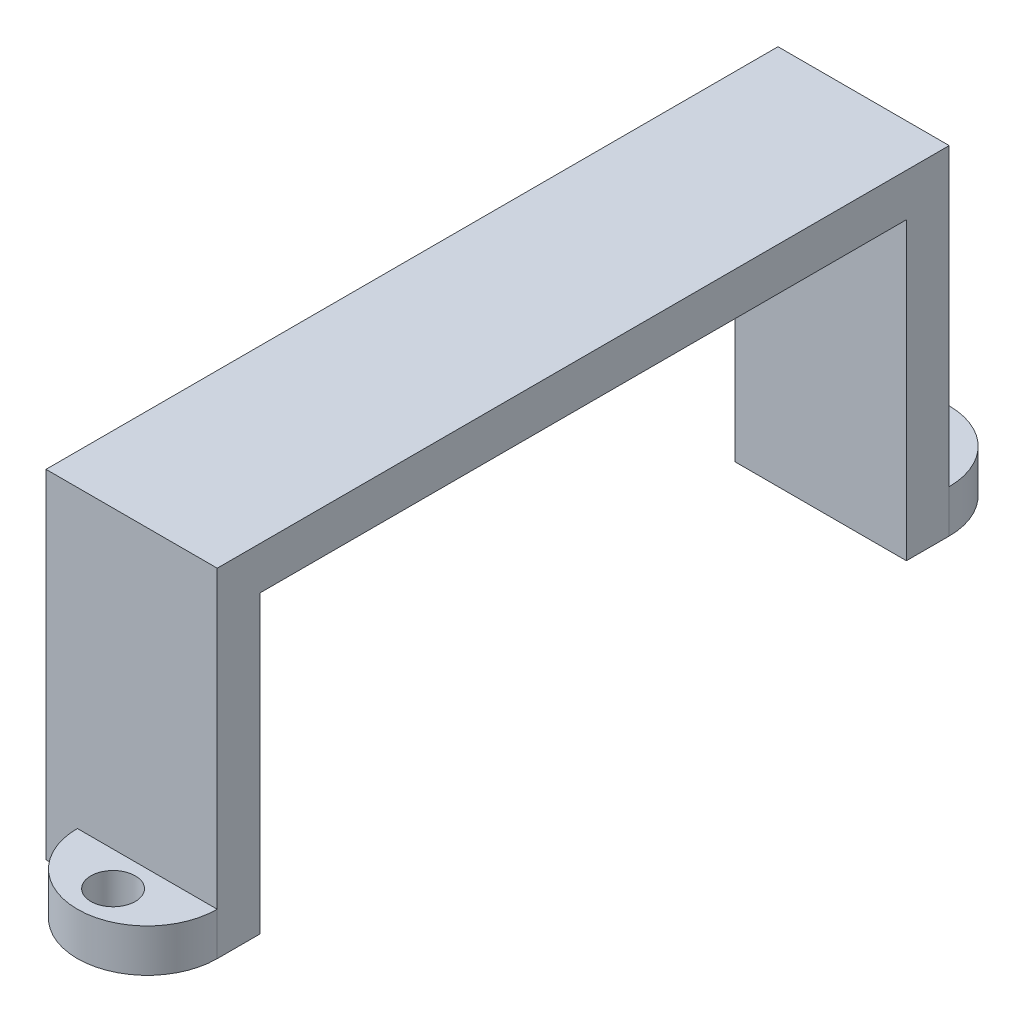
from build123d import *

# Parameters (mm, degrees)
SKETCH1_W             = 10.16
SKETCH1_H             = 2.54
BOSS_EXTRUDE1_DEPTH   = 17.526
BOSS_EXTRUDE1_2_DEPTH = 17.526
SKETCH2_W             = 10.16
SKETCH2_H             = 43.434
BOSS_EXTRUDE2_DEPTH   = 2.54
SKETCH3_R             = 1.319522672
SKETCH3_R_2           = 1.34985913
BOSS_EXTRUDE3_DEPTH   = 2.54


with BuildPart() as part:
    # Sketch1 → Boss-Extrude1 (new body)
    with BuildSketch(Plane(origin=(0, 0, 0), x_dir=(1, 0, 0), z_dir=(0, 1, 0))):
        with Locations((-19.169529412, 14.552705882)):
            Rectangle(SKETCH1_W, SKETCH1_H)
    extrude(amount=BOSS_EXTRUDE1_DEPTH)



with BuildPart() as body_2:
    # Sketch1 → Boss-Extrude1 2 (new body)
    with BuildSketch(Plane(origin=(0, 0, 0), x_dir=(1, 0, 0), z_dir=(0, 1, 0))):
        with Locations((-19.169529412, -26.341294118)):
            Rectangle(SKETCH1_W, SKETCH1_H)
    extrude(amount=BOSS_EXTRUDE1_2_DEPTH)


with BuildPart() as part_1:
    add(part.part)

    add(body_2.part)  # Boss-Extrude2 merges body 2
    # Sketch2 → Boss-Extrude2 (add)
    with BuildSketch(Plane(origin=(0, 17.526, 0), x_dir=(1, 0, 0), z_dir=(0, 1, 0))):
        with Locations((-19.169529412, -5.894294118)):
            Rectangle(SKETCH2_W, SKETCH2_H)
    extrude(amount=BOSS_EXTRUDE2_DEPTH)

    # Sketch3 → Boss-Extrude3 (add)
    # profile 1 of 2: a face of its own
    with BuildSketch(Plane.XZ):
        with BuildLine():
            Line((-22.386628374, 27.611294118), (-14.089529412, 27.611294118))
            ThreePointArc((-14.089529412, 27.611294118), (-18.238078893, 31.759843599), (-22.386628374, 27.611294118))
        make_face()
        with Locations(Location((-18.238078893, 29.643294118, 0), (0, 0, 270))):
            Circle(SKETCH3_R, mode=Mode.SUBTRACT)
    # profile 2 of 2: a face of its own
    with BuildSketch(Plane.XZ):
        with BuildLine():
            Line((-22.386628374, -15.822705882), (-14.089529412, -15.822705882))
            ThreePointArc((-14.089529412, -15.822705882), (-18.238078893, -19.971255363), (-22.386628374, -15.822705882))
        make_face()
        with Locations(Location((-18.238078893, -17.854705882, 0), (0, 0, 270))):
            Circle(SKETCH3_R_2, mode=Mode.SUBTRACT)
    extrude(amount=-BOSS_EXTRUDE3_DEPTH)


solid = part_1.part
